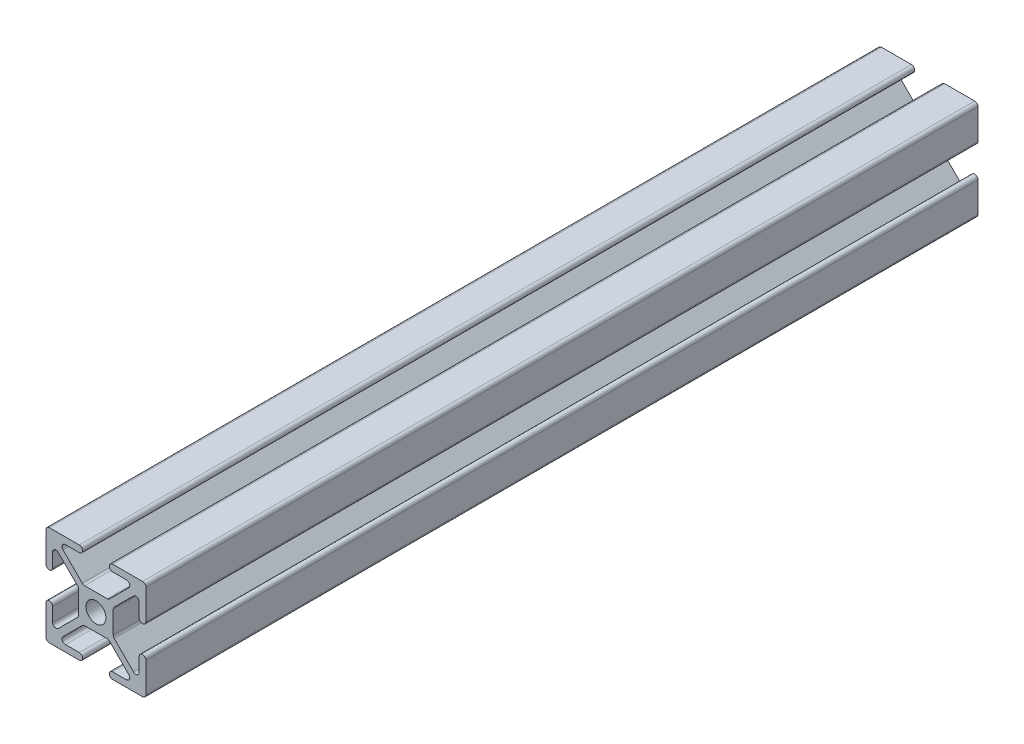
from build123d import *

# Parameters (mm, degrees)
SALIENTE_EXTRUIR1_DEPTH = 1400
CROQUIS2_R              = 3
CORTAR_EXTRUIR1_DEPTH   = 1401.160705062
CORTAR_EXTRUIR3_DEPTH   = 1401.160705062
CROQUIS4_W              = 1150
CROQUIS4_H              = 72.748415438
CORTAR_EXTRUIR5_DEPTH   = 254


with BuildPart() as part:
    # Croquis1 → Saliente-Extruir1 (new body)
    with BuildSketch(Plane.XY):
        with BuildLine():
            Line((-14, 15), (14, 15))
            ThreePointArc((14, 15), (14.707106781, 14.707106781), (15, 14))
            Line((15, 14), (15, -14))
            ThreePointArc((15, -14), (14.707106781, -14.707106781), (14, -15))
            Line((14, -15), (-14, -15))
            ThreePointArc((-14, -15), (-14.707106781, -14.707106781), (-15, -14))
            Line((-15, -14), (-15, 14))
            ThreePointArc((-15, 14), (-14.707106781, 14.707106781), (-14, 15))
        make_face()
    extrude(amount=-SALIENTE_EXTRUIR1_DEPTH)

    # Croquis2 → Cortar-Extruir1 (cut, through all)
    with BuildSketch(Plane.XY):
        Circle(CROQUIS2_R)
    extrude(amount=-CORTAR_EXTRUIR1_DEPTH, mode=Mode.SUBTRACT)

    # Croquis3 → Cortar-Extruir3 (cut, through all)
    with BuildSketch(Plane.XY):
        with BuildLine():
            Line((-5.492893219, 4.078679656), (-11.292893219, 9.878679656))
            ThreePointArc((-11.292893219, 9.878679656), (-12.382683432, 10.095452408), (-13, 9.171572875))
            Line((-13, 9.171572875), (-13, 5))
            ThreePointArc((-13, 5), (-14, 4), (-15, 5))
            Line((-15, 5), (-15, -5))
            ThreePointArc((-15, -5), (-14, -4), (-13, -5))
            Line((-13, -5), (-13, -9.171572875))
            ThreePointArc((-13, -9.171572875), (-12.382683432, -10.095452408), (-11.292893219, -9.878679656))
            Line((-11.292893219, -9.878679656), (-5.492893219, -4.078679656))
            ThreePointArc((-5.492893219, -4.078679656), (-5.276120467, -3.754256308), (-5.2, -3.371572875))
            Line((-5.2, -3.371572875), (-5.2, 3.371572875))
            ThreePointArc((-5.2, 3.371572875), (-5.276120467, 3.754256308), (-5.492893219, 4.078679656))
        make_face()
        with BuildLine():
            ThreePointArc((-9.171572875, 13), (-10.095452408, 12.382683432), (-9.878679656, 11.292893219))
            Line((-9.878679656, 11.292893219), (-4.078679656, 5.492893219))
            ThreePointArc((-4.078679656, 5.492893219), (-3.754256308, 5.276120467), (-3.371572875, 5.2))
            Line((-3.371572875, 5.2), (3.371572875, 5.2))
            ThreePointArc((3.371572875, 5.2), (3.754256308, 5.276120467), (4.078679656, 5.492893219))
            Line((4.078679656, 5.492893219), (9.878679656, 11.292893219))
            ThreePointArc((9.878679656, 11.292893219), (10.095452408, 12.382683432), (9.171572875, 13))
            Line((9.171572875, 13), (5, 13))
            ThreePointArc((5, 13), (4, 14), (5, 15))
            Line((5, 15), (-5, 15))
            ThreePointArc((-5, 15), (-4.292893219, 14.707106781), (-4, 14))
            ThreePointArc((-4, 14), (-4.292893219, 13.292893219), (-5, 13))
            Line((-5, 13), (-9.171572875, 13))
        make_face()
        with BuildLine():
            Line((9.878679656, -11.292893219), (4.078679656, -5.492893219))
            ThreePointArc((4.078679656, -5.492893219), (3.754256308, -5.276120467), (3.371572875, -5.2))
            Line((3.371572875, -5.2), (-3.371572875, -5.2))
            ThreePointArc((-3.371572875, -5.2), (-3.754256308, -5.276120467), (-4.078679656, -5.492893219))
            Line((-4.078679656, -5.492893219), (-9.878679656, -11.292893219))
            ThreePointArc((-9.878679656, -11.292893219), (-10.095452408, -12.382683432), (-9.171572875, -13))
            Line((-9.171572875, -13), (-5, -13))
            ThreePointArc((-5, -13), (-4.292893219, -13.292893219), (-4, -14))
            ThreePointArc((-4, -14), (-4.292893219, -14.707106781), (-5, -15))
            Line((-5, -15), (5, -15))
            ThreePointArc((5, -15), (4, -14), (5, -13))
            Line((5, -13), (9.171572875, -13))
            ThreePointArc((9.171572875, -13), (10.095452408, -12.382683432), (9.878679656, -11.292893219))
        make_face()
        with BuildLine():
            ThreePointArc((13, 9.171572875), (12.382683432, 10.095452408), (11.292893219, 9.878679656))
            Line((11.292893219, 9.878679656), (5.492893219, 4.078679656))
            ThreePointArc((5.492893219, 4.078679656), (5.276120467, 3.754256308), (5.2, 3.371572875))
            Line((5.2, 3.371572875), (5.2, -3.371572875))
            ThreePointArc((5.2, -3.371572875), (5.276120467, -3.754256308), (5.492893219, -4.078679656))
            Line((5.492893219, -4.078679656), (11.292893219, -9.878679656))
            ThreePointArc((11.292893219, -9.878679656), (12.382683432, -10.095452408), (13, -9.171572875))
            Line((13, -9.171572875), (13, -5))
            ThreePointArc((13, -5), (14, -4), (15, -5))
            Line((15, -5), (15, 5))
            ThreePointArc((15, 5), (14, 4), (13, 5))
            Line((13, 5), (13, 9.171572875))
        make_face()
    extrude(amount=-CORTAR_EXTRUIR3_DEPTH, mode=Mode.SUBTRACT)

    # Croquis4 → Cortar-Extruir5 (cut)
    with BuildSketch(Plane.ZY.offset(15)):
        with Locations((-825, -21.374207719)):
            Rectangle(CROQUIS4_W, CROQUIS4_H)
    extrude(amount=-CORTAR_EXTRUIR5_DEPTH, mode=Mode.SUBTRACT)


solid = part.part
